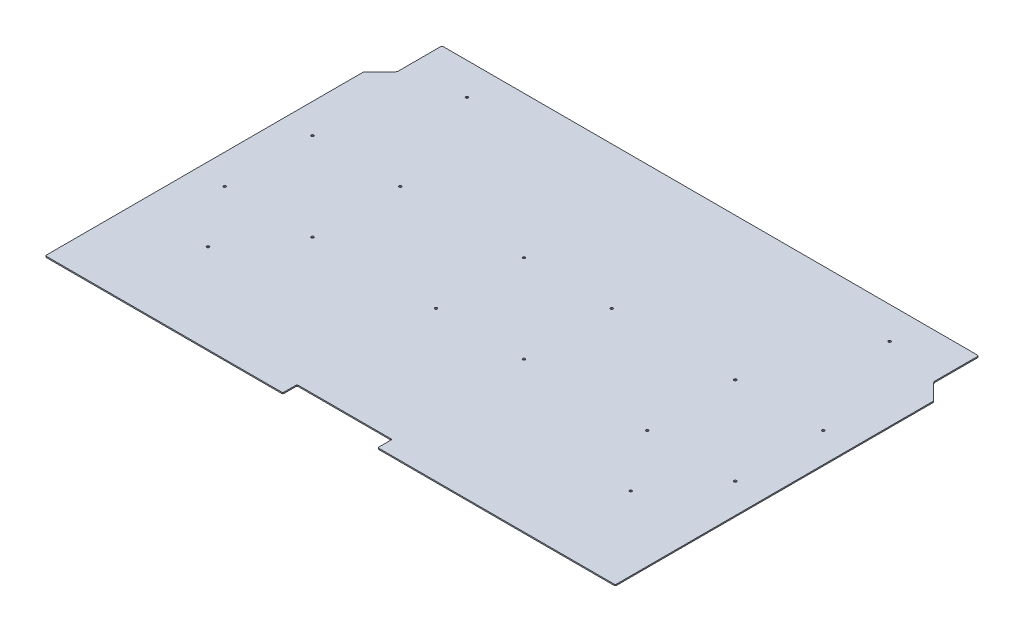
from build123d import *

# Parameters (mm, degrees)
BOSS_EXTRUDE1_DEPTH              = 3.175
F_17_64_0_26563_DIAMETER_HOLE1_D = 6.747002
SKETCH5_W                        = 254
SKETCH5_H                        = 38.1
CUT_EXTRUDE1_DEPTH               = 916.815527617
FILLET1_R                        = 3.175


with BuildPart() as part:
    # Sketch1 → Boss-Extrude1 (new body)
    with BuildSketch(Plane(origin=(0, 0, 0), x_dir=(1, 0, 0), z_dir=(0, 1, 0))):
        with BuildLine():
            Line((-717.55, 504.825), (-717.55, 392.610512242))
            ThreePointArc((-717.55, 392.610512242), (-718.516729937, 387.750432651), (-721.269743879, 383.630256121))
            Line((-721.269743879, 383.630256121), (-761.07006403, 343.82993597))
            ThreePointArc((-761.07006403, 343.82993597), (-761.758317516, 342.799891837), (-762, 341.584871939))
            Line((-762, 341.584871939), (-762, -504.825))
            ThreePointArc((-762, -504.825), (-761.07006403, -507.07006403), (-758.825, -508))
            Line((-758.825, -508), (758.825, -508))
            ThreePointArc((758.825, -508), (761.07006403, -507.07006403), (762, -504.825))
            Line((762, -504.825), (762, 341.584871939))
            ThreePointArc((762, 341.584871939), (761.758317516, 342.799891837), (761.07006403, 343.82993597))
            Line((761.07006403, 343.82993597), (721.269743879, 383.630256121))
            ThreePointArc((721.269743879, 383.630256121), (718.516729937, 387.750432651), (717.55, 392.610512242))
            Line((717.55, 392.610512242), (717.55, 504.825))
            ThreePointArc((717.55, 504.825), (716.62006403, 507.07006403), (714.375, 508))
            Line((714.375, 508), (-714.375, 508))
            ThreePointArc((-714.375, 508), (-716.62006403, 507.07006403), (-717.55, 504.825))
        make_face()
    extrude(amount=BOSS_EXTRUDE1_DEPTH)

    # 17/64 (0.26563) Diameter Hole1 (through all)
    with Locations(Plane(origin=(0, 3.175, 0), x_dir=(1, 0, 0), z_dir=(0, 1, 0))):
        with Locations((-565.15, 422.275), (565.15, 422.275), (565.15, -269.875), (-565.15, -269.875), (-682.625, 127), (-447.675, 127), (-682.625, -107.95), (-447.675, -107.95), (-117.475, 127), (117.475, 127), (-117.475, -107.95), (117.475, -107.95), (447.675, 127), (682.625, 127), (447.675, -107.95), (682.625, -107.95)):
            Hole(F_17_64_0_26563_DIAMETER_HOLE1_D / 2)

    # Sketch5 → Cut-Extrude1 (cut, through all)
    with BuildSketch(Plane(origin=(0, 3.175, 0), x_dir=(1, 0, 0), z_dir=(0, 1, 0))):
        with Locations((0, -488.95)):
            Rectangle(SKETCH5_W, SKETCH5_H)
    extrude(amount=-CUT_EXTRUDE1_DEPTH, mode=Mode.SUBTRACT)

    # Fillet1
    fillet1_edges = [part.edges().sort_by_distance(p)[0] for p in [
        (-127, 1.5875, 508),
        (-127, 1.5875, 469.9),
        (127, 1.5875, 469.9),
        (127, 1.5875, 508),
    ]]
    fillet(fillet1_edges, radius=FILLET1_R)


solid = part.part
